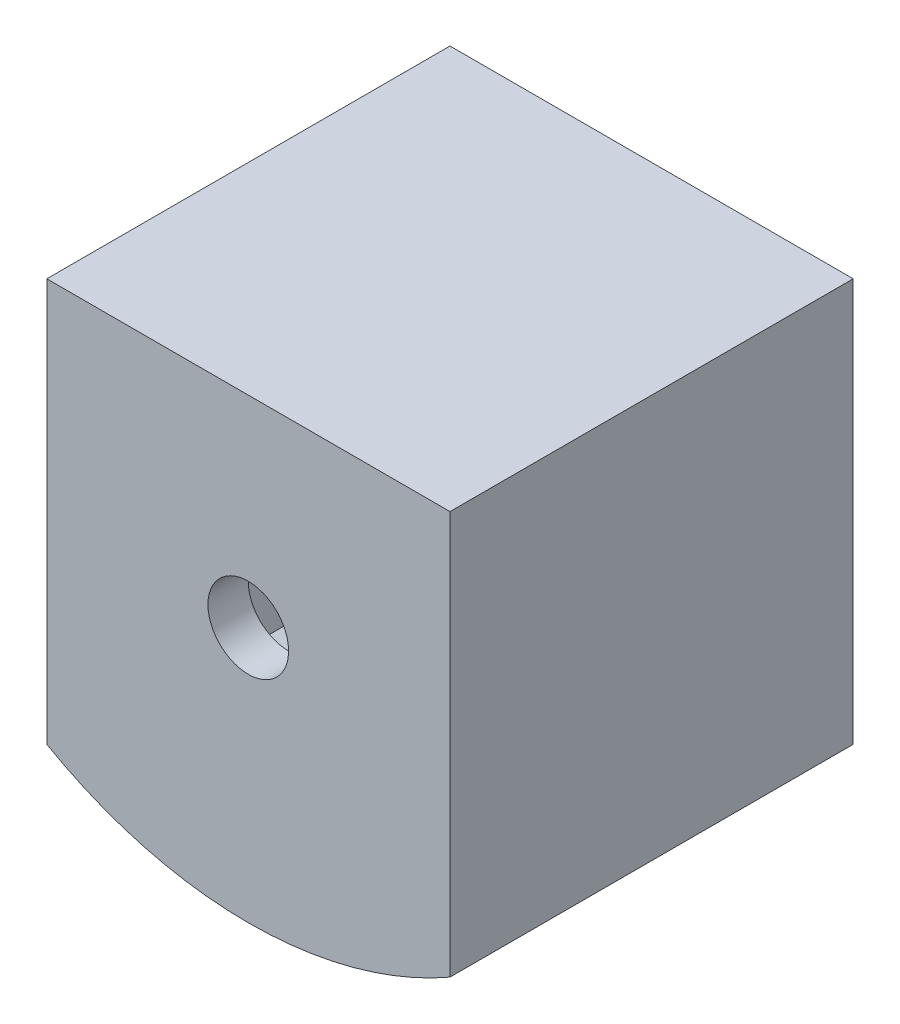
from build123d import *

# Parameters (mm, degrees)
BOSS_EXTRUDE1_DEPTH = 30
SHELL13_T           = -3
SKETCH3_R           = 3
CUT_EXTRUDE2_DEPTH  = 3
SKETCH4_W           = 10
SKETCH4_H           = 1
SKETCH4_W_2         = 1
SKETCH4_H_2         = 10
SKETCH4_W_3         = 7
CUT_EXTRUDE3_DEPTH  = 5


with BuildPart() as part:
    # Sketch1 → Boss-Extrude1 (new body)
    with BuildSketch(Plane.XY):
        with BuildLine():
            Line((15, -15), (15, 15))
            Line((15, 15), (-15, 15))
            Line((-15, 15), (-15, -15))
            ThreePointArc((-15, -15), (0, -19.004680178), (15, -15))
        make_face()
    extrude(amount=BOSS_EXTRUDE1_DEPTH)

    # Shell13
    shell13_openings = [part.faces().sort_by_distance(p)[0] for p in [
        (0, -1.375060702, 0),
    ]]
    offset(amount=SHELL13_T, openings=shell13_openings, kind=Kind.INTERSECTION)

    # Sketch3 → Cut-Extrude2 (cut)
    with BuildSketch(Plane(origin=(0, 0, 27), x_dir=(-1, 0, 0), z_dir=(0, 0, -1))):
        with Locations((0.010259738, 0.007572697)):
            Circle(SKETCH3_R)
    extrude(amount=-CUT_EXTRUDE2_DEPTH, mode=Mode.SUBTRACT)

    # Sketch4 → Cut-Extrude3 (cut)
    with BuildSketch(Plane(origin=(0, 0, 0), x_dir=(-1, 0, 0), z_dir=(0, 0, -1))):
        with Locations((0, 13.5)):
            Rectangle(SKETCH4_W, SKETCH4_H)
        with Locations((-13.5, 0)):
            Rectangle(SKETCH4_W_2, SKETCH4_H_2)
        with Locations((0, -17.5)):
            Rectangle(SKETCH4_W_3, SKETCH4_H)
        with Locations((13.5, 0)):
            Rectangle(SKETCH4_W_2, SKETCH4_H_2)
    extrude(amount=-CUT_EXTRUDE3_DEPTH, mode=Mode.SUBTRACT)


solid = part.part
